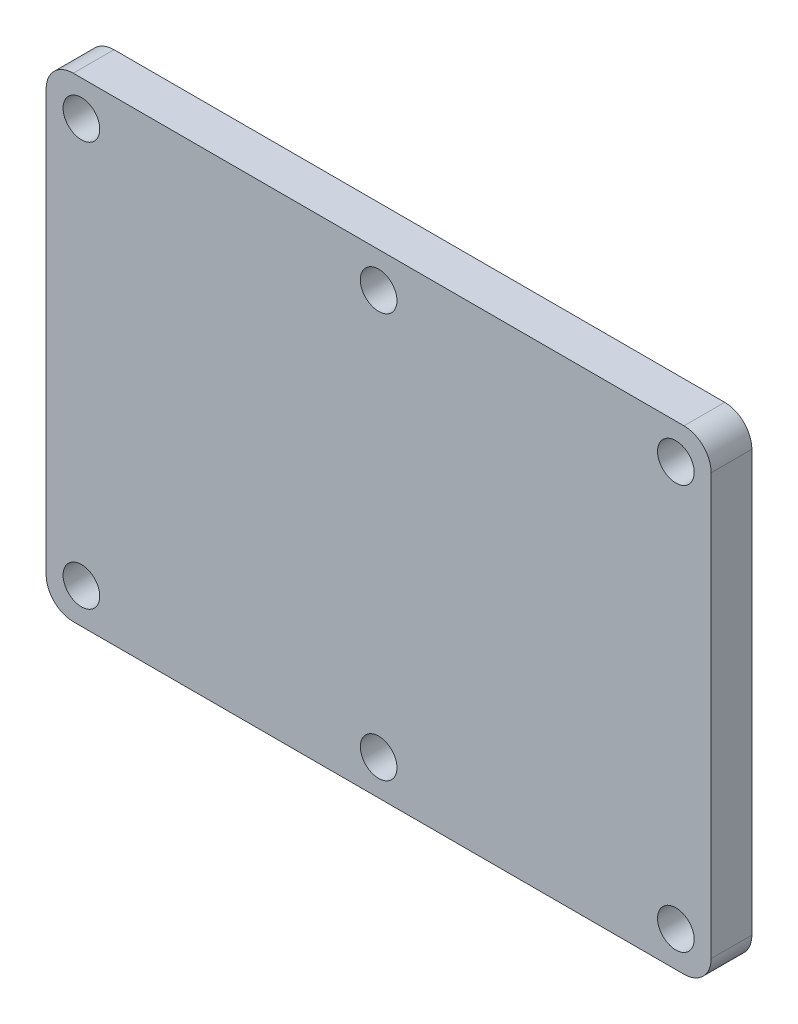
from build123d import *

# Parameters (mm, degrees)
ESBO_O1_W                = 49
ESBO_O1_H                = 35
RESSALTO_EXTRUS_O1_DEPTH = 3
ESBO_O2_R                = 1.35
CORTE_EXTRUS_O1_DEPTH    = 31.257230541
ESBO_O3_W                = 49
ESBO_O3_H                = 3
RESSALTO_EXTRUS_O3_DEPTH = 8
ESBO_O4_R                = 1.35
CORTE_EXTRUS_O2_DEPTH    = 44.465503563
FILETE1_R                = 2
FILETE2_R                = 2
CORTE_EXTRUS_O3_DEPTH    = 10
FILETE3_R                = 2
ESBO_O6_R                = 1.35
CORTE_EXTRUS_O4_DEPTH    = 31.257230541


with BuildPart() as part:
    # Esboço1 → Ressalto-extrusão1 (new body)
    with BuildSketch(Plane.XY):
        Rectangle(ESBO_O1_W, ESBO_O1_H)
    extrude(amount=RESSALTO_EXTRUS_O1_DEPTH)

    # Esboço2 → Corte-extrusão1 (cut, through all)
    with BuildSketch(Plane(origin=(0, 0, 0), x_dir=(-1, 0, 0), z_dir=(0, 0, -1))):
        with Locations((-21.9, -14.9)):
            Circle(ESBO_O2_R)
        with Locations((0, -14.9)):
            Circle(ESBO_O2_R)
        with Locations((21.9, -14.9)):
            Circle(ESBO_O2_R)
    extrude(amount=-CORTE_EXTRUS_O1_DEPTH, mode=Mode.SUBTRACT)

    # Esboço3 → Ressalto-extrusão3 (add)
    with BuildSketch(Plane(origin=(0, 0, 0), x_dir=(-1, 0, 0), z_dir=(0, 0, -1))):
        with Locations((0, 16)):
            Rectangle(ESBO_O3_W, ESBO_O3_H)
    extrude(amount=RESSALTO_EXTRUS_O3_DEPTH)

    # Esboço4 → Corte-extrusão2 (cut, through all)
    with BuildSketch(Plane(origin=(0, 17.5, 0), x_dir=(1, 0, 0), z_dir=(0, 1, 0))):
        with Locations(Location((-21.9, 5.4, 0), (0, 0, 270))):
            Circle(ESBO_O4_R)
        with Locations(Location((0, 5.4, 0), (0, 0, 270))):
            Circle(ESBO_O4_R)
        with Locations(Location((21.9, 5.4, 0), (0, 0, 270))):
            Circle(ESBO_O4_R)
    extrude(amount=-CORTE_EXTRUS_O2_DEPTH, mode=Mode.SUBTRACT)

    # Filete1
    filete1_edges = [part.edges().sort_by_distance(p)[0] for p in [
        (24.5, -17.5, 1.5),
        (-24.5, -17.5, 1.5),
    ]]
    fillet(filete1_edges, radius=FILETE1_R)

    # Filete2
    filete2_edges = [part.edges().sort_by_distance(p)[0] for p in [
        (24.5, 16, -8),
        (-24.5, 16, -8),
    ]]
    fillet(filete2_edges, radius=FILETE2_R)

    # Esboço5 → Corte-extrusão3 (cut)
    with BuildSketch(Plane(origin=(0, 14.5, 0), x_dir=(-1, 0, 0), z_dir=(0, -1, 0))):
        Polygon((24.5, 0), (24.5, 8), (22.5, 8), (-24.5, 8), (-24.5, 0), align=None)
    extrude(amount=-CORTE_EXTRUS_O3_DEPTH, mode=Mode.SUBTRACT)

    # Filete3
    filete3_edges = [part.edges().sort_by_distance(p)[0] for p in [
        (-24.5, 17.5, 1.5),
        (24.5, 17.5, 1.5),
    ]]
    fillet(filete3_edges, radius=FILETE3_R)

    # Esboço6 → Corte-extrusão4 (cut, through all)
    with BuildSketch(Plane.XY.offset(3)):
        with Locations((21.9, 14.9)):
            Circle(ESBO_O6_R)
        with Locations((0, 14.9)):
            Circle(ESBO_O6_R)
        with Locations((-21.9, 14.9)):
            Circle(ESBO_O6_R)
    extrude(amount=-CORTE_EXTRUS_O4_DEPTH, mode=Mode.SUBTRACT)


solid = part.part
